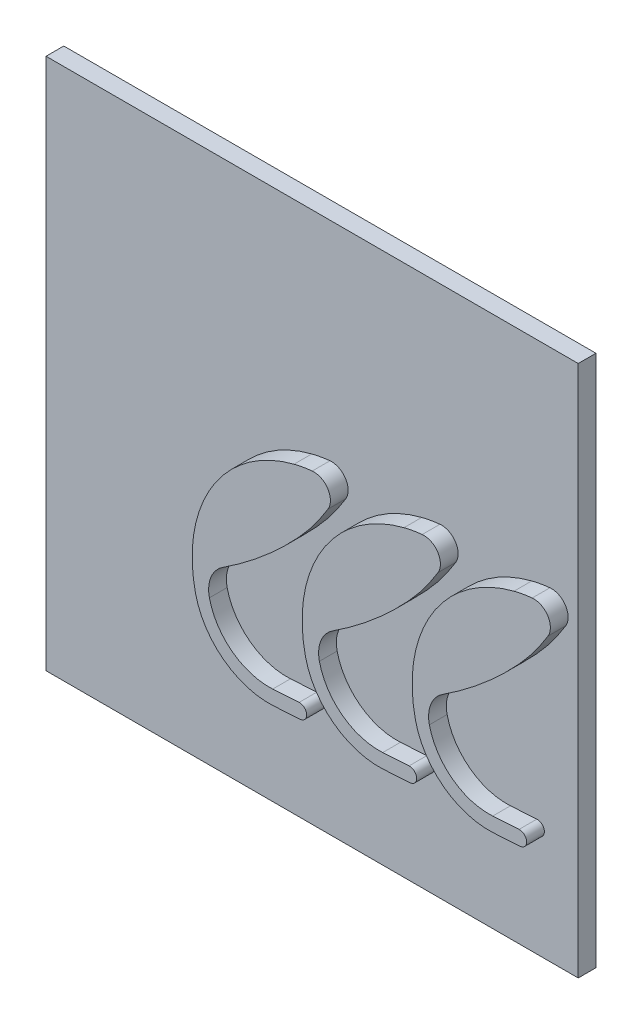
from build123d import *

# Parameters (mm, degrees)
SKICA1_W                = 300
SKICA1_H                = 300
P_IDAT_VYSUNUT_M1_DEPTH = 10
P_IDAT_VYSUNUT_M3_DEPTH = 10


with BuildPart() as part:
    # Skica1 → Přidat vysunutím1 (new body)
    with BuildSketch(Plane.XY):
        with Locations((150, 150)):
            Rectangle(SKICA1_W, SKICA1_H)
    extrude(amount=P_IDAT_VYSUNUT_M1_DEPTH)

    # Skica3 → Přidat vysunutím3 (add)
    with BuildSketch(Plane.XY.offset(10)):
        with BuildLine():
            Line((153.157459628, 57.904394304), (138.29070055, 56.980883154))
            ThreePointArc((138.29070055, 56.980883154), (110.247943411, 65.348513102), (94.289058074, 89.878646361))
            ThreePointArc((94.289058074, 89.878646361), (103.547245504, 146.603196293), (149.788099838, 180.737812008))
            ThreePointArc((149.788099838, 180.737812008), (154.882621426, 181.830553973), (160.045482007, 182.53276892))
            ThreePointArc((160.045482007, 182.53276892), (168.864101161, 178.213116415), (168.96323198, 168.393869264))
            ThreePointArc((168.96323198, 168.393869264), (161.268139192, 156.982073578), (152.456108269, 146.408916775))
            ThreePointArc((152.456108269, 146.408916775), (132.164950971, 127.005263014), (109.623212842, 110.268988463))
            ThreePointArc((109.623212842, 110.268988463), (102.928809573, 102.150565652), (102.087824963, 91.661687307))
            ThreePointArc((102.087824963, 91.661687307), (115.038295459, 71.755737716), (137.794703021, 64.965492503))
            Line((137.794703021, 64.965492503), (152.6614621, 65.889003653))
            ThreePointArc((152.6614621, 65.889003653), (156.901765538, 62.144697743), (153.157459628, 57.904394304))
        make_face()
        with BuildLine():
            Line((215.157459628, 57.904394304), (200.29070055, 56.980883154))
            ThreePointArc((200.29070055, 56.980883154), (172.247943411, 65.348513102), (156.289058074, 89.878646361))
            ThreePointArc((156.289058074, 89.878646361), (165.547245504, 146.603196293), (211.788099838, 180.737812008))
            ThreePointArc((211.788099838, 180.737812008), (216.882621426, 181.830553973), (222.045482007, 182.53276892))
            ThreePointArc((222.045482007, 182.53276892), (230.864101161, 178.213116415), (230.96323198, 168.393869264))
            ThreePointArc((230.96323198, 168.393869264), (223.268139192, 156.982073578), (214.456108269, 146.408916775))
            ThreePointArc((214.456108269, 146.408916775), (194.164950971, 127.005263014), (171.623212842, 110.268988463))
            ThreePointArc((171.623212842, 110.268988463), (164.928809573, 102.150565652), (164.087824963, 91.661687307))
            ThreePointArc((164.087824963, 91.661687307), (177.038295459, 71.755737716), (199.794703021, 64.965492503))
            Line((199.794703021, 64.965492503), (214.6614621, 65.889003653))
            ThreePointArc((214.6614621, 65.889003653), (218.901765538, 62.144697743), (215.157459628, 57.904394304))
        make_face()
        with BuildLine():
            Line((277.157459628, 57.904394304), (262.29070055, 56.980883154))
            ThreePointArc((262.29070055, 56.980883154), (234.247943411, 65.348513102), (218.289058074, 89.878646361))
            ThreePointArc((218.289058074, 89.878646361), (227.547245504, 146.603196293), (273.788099838, 180.737812008))
            ThreePointArc((273.788099838, 180.737812008), (278.882621426, 181.830553973), (284.045482007, 182.53276892))
            ThreePointArc((284.045482007, 182.53276892), (292.864101161, 178.213116415), (292.96323198, 168.393869264))
            ThreePointArc((292.96323198, 168.393869264), (285.268139192, 156.982073578), (276.456108269, 146.408916775))
            ThreePointArc((276.456108269, 146.408916775), (256.164950971, 127.005263014), (233.623212842, 110.268988463))
            ThreePointArc((233.623212842, 110.268988463), (226.928809573, 102.150565652), (226.087824963, 91.661687307))
            ThreePointArc((226.087824963, 91.661687307), (239.038295459, 71.755737716), (261.794703021, 64.965492503))
            Line((261.794703021, 64.965492503), (276.6614621, 65.889003653))
            ThreePointArc((276.6614621, 65.889003653), (280.901765538, 62.144697743), (277.157459628, 57.904394304))
        make_face()
    extrude(amount=P_IDAT_VYSUNUT_M3_DEPTH)


solid = part.part
